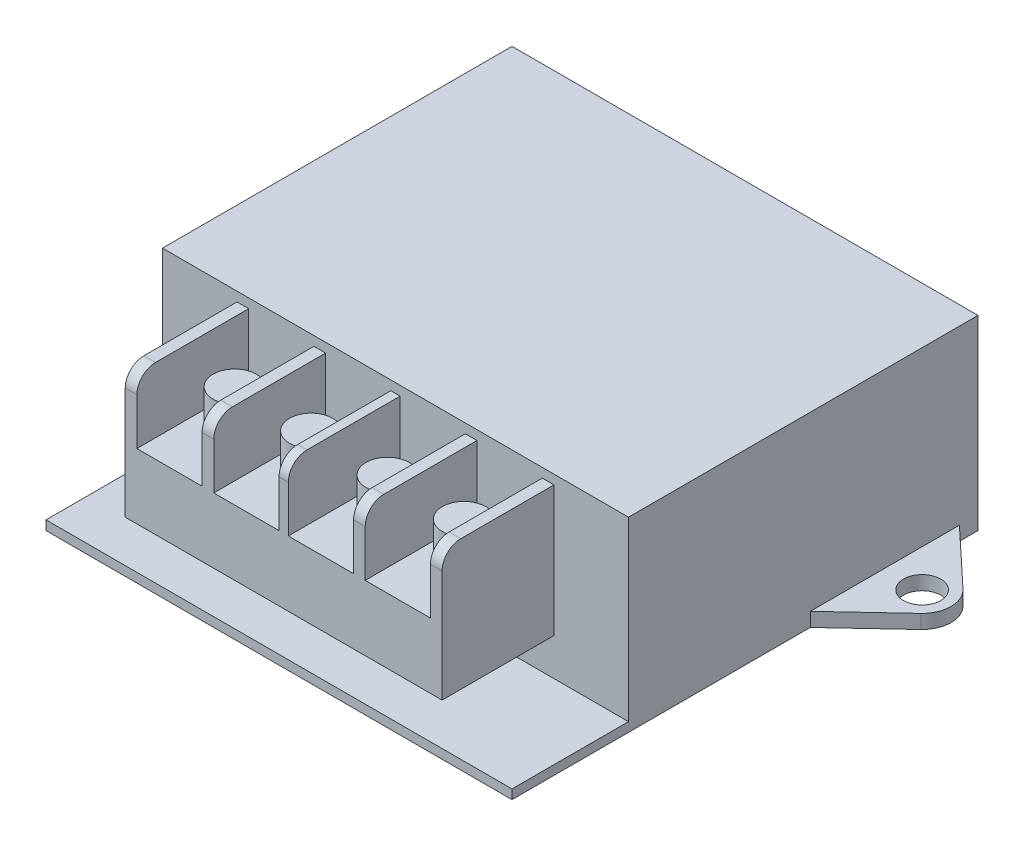
from build123d import *

# Parameters (mm, degrees)
SKETCH1_W           = 50
SKETCH1_H           = 50
BOSS_EXTRUDE1_DEPTH = 1
SKETCH2_W           = 50
SKETCH2_H           = 37.5
BOSS_EXTRUDE2_DEPTH = 19
SKETCH3_W           = 34
SKETCH3_H           = 14
BOSS_EXTRUDE3_DEPTH = 12
SKETCH4_R           = 2
BOSS_EXTRUDE4_DEPTH = 1.5
SKETCH5_W           = 7
SKETCH5_H           = 12
CUT_EXTRUDE1_DEPTH  = 7
FILLET1_R           = 2
SKETCH6_R           = 2.32139267
BOSS_EXTRUDE5_DEPTH = 4
LPATTERN1_COUNT     = 4
LPATTERN1_PITCH     = 8.2


with BuildPart() as part:
    # Sketch1 → Boss-Extrude1 (new body)
    with BuildSketch(Plane(origin=(0, 0, 0), x_dir=(1, 0, 0), z_dir=(0, 1, 0))):
        with Locations((25, 25)):
            Rectangle(SKETCH1_W, SKETCH1_H)
    extrude(amount=BOSS_EXTRUDE1_DEPTH)

    # Sketch2 → Boss-Extrude2 (add)
    with BuildSketch(Plane(origin=(0, 1, 0), x_dir=(1, 0, 0), z_dir=(0, 1, 0))):
        with Locations((25, 31.25)):
            Rectangle(SKETCH2_W, SKETCH2_H)
    extrude(amount=BOSS_EXTRUDE2_DEPTH)

    # Sketch3 → Boss-Extrude3 (add)
    with BuildSketch(Plane.XY.offset(-12.5)):
        with Locations((25, 12)):
            Rectangle(SKETCH3_W, SKETCH3_H)
    extrude(amount=BOSS_EXTRUDE3_DEPTH)

    # Sketch4 → Boss-Extrude4 (add)
    with BuildSketch(Plane.XZ):
        with BuildLine():
            Line((0, -32.003753373), (-6.121503896, -37.739612135))
            ThreePointArc((-6.121503896, -37.739612135), (-7.102759148, -40.003753373), (-6.121503896, -42.267894612))
            Line((-6.121503896, -42.267894612), (0, -48.003753373))
            Line((0, -48.003753373), (0, -32.003753373))
        make_face()
        with Locations(Location((-4, -40.003753373, 0), (0, 0, 270))):
            Circle(SKETCH4_R, mode=Mode.SUBTRACT)
    boss_extrude4 = extrude(amount=-BOSS_EXTRUDE4_DEPTH)

    # Mirror1: Boss-Extrude4 across plane
    add(boss_extrude4.mirror(Plane.ZY.offset(-25)))

    # Sketch5 → Cut-Extrude1 (cut)
    with BuildSketch(Plane(origin=(0, 19, 0), x_dir=(1, 0, 0), z_dir=(0, 1, 0))):
        with Locations((21, 6.5)):
            Rectangle(SKETCH5_W, SKETCH5_H)
        with Locations((29, 6.5)):
            Rectangle(SKETCH5_W, SKETCH5_H)
        with Locations((37.25, 6.5)):
            Rectangle(SKETCH5_W, SKETCH5_H)
        with Locations((12.75, 6.5)):
            Rectangle(SKETCH5_W, SKETCH5_H)
    extrude(amount=-CUT_EXTRUDE1_DEPTH, mode=Mode.SUBTRACT)

    # Fillet1
    fillet1_edges = [part.edges().sort_by_distance(p)[0] for p in [
        (41.375, 19, -0.5),
        (33.125, 19, -0.5),
        (25, 19, -0.5),
        (16.875, 19, -0.5),
        (8.625, 19, -0.5),
    ]]
    fillet(fillet1_edges, radius=FILLET1_R)

    # Sketch6 → Boss-Extrude5 (add)
    with BuildSketch(Plane(origin=(0, 12, 0), x_dir=(1, 0, 0), z_dir=(0, 1, 0))):
        with Locations(Location((12.75, 7.5, 0), (0, 0, 90))):
            Circle(SKETCH6_R)
    boss_extrude5 = extrude(amount=BOSS_EXTRUDE5_DEPTH)

    # LPattern1: Boss-Extrude5 ×4
    with Locations(*[(i * LPATTERN1_PITCH, 0, 0) for i in range(1, LPATTERN1_COUNT)]):
        add(boss_extrude5)


solid = part.part
